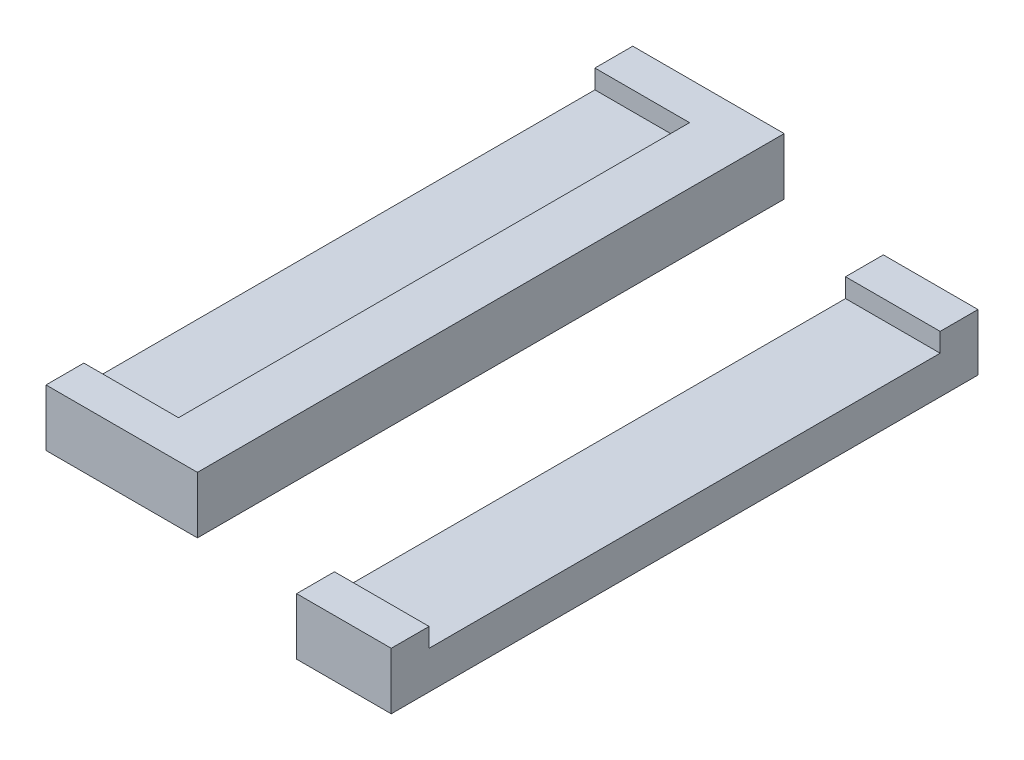
from build123d import *

# Parameters (mm, degrees)
SKETCH1_W             = 8
SKETCH1_H             = 31
BOSS_EXTRUDE1_DEPTH   = 2
SKETCH1_W_2           = 5
BOSS_EXTRUDE1_2_DEPTH = 2
SKETCH2_W             = 5
SKETCH2_H             = 2
BOSS_EXTRUDE2_DEPTH   = 1


with BuildPart() as part:
    # Sketch1 → Boss-Extrude1 (new body)
    with BuildSketch(Plane(origin=(0, 0, 0), x_dir=(1, 0, 0), z_dir=(0, 1, 0))):
        with Locations((-8.225352113, -10.288732394)):
            Rectangle(SKETCH1_W, SKETCH1_H)
    extrude(amount=BOSS_EXTRUDE1_DEPTH)



with BuildPart() as body_2:
    # Sketch1 → Boss-Extrude1 2 (new body)
    with BuildSketch(Plane(origin=(0, 0, 0), x_dir=(1, 0, 0), z_dir=(0, 1, 0))):
        with Locations((6.443661972, -13.218309859)):
            Rectangle(SKETCH1_W_2, SKETCH1_H)
    extrude(amount=BOSS_EXTRUDE1_2_DEPTH)


with BuildPart() as part_1:
    add(part.part)

    add(body_2.part)  # Boss-Extrude2 merges body 2
    # Sketch2 → Boss-Extrude2 (add)
    with BuildSketch(Plane(origin=(0, 2, 0), x_dir=(1, 0, 0), z_dir=(0, 1, 0))):
        Polygon((-12.225352113, -23.788732394), (-12.225352113, -25.788732394), (-4.225352113, -25.788732394), (-4.225352113, -23.788732394), (-4.225352113, 3.211267606), (-4.225352113, 5.211267606), (-12.225352113, 5.211267606), (-12.225352113, 3.211267606), (-7.225352113, 3.211267606), (-7.225352113, -23.788732394), align=None)
        with Locations((6.443661972, 1.281690141)):
            Rectangle(SKETCH2_W, SKETCH2_H)
        with Locations((6.443661972, -27.718309859)):
            Rectangle(SKETCH2_W, SKETCH2_H)
    extrude(amount=BOSS_EXTRUDE2_DEPTH)


solid = part_1.part
